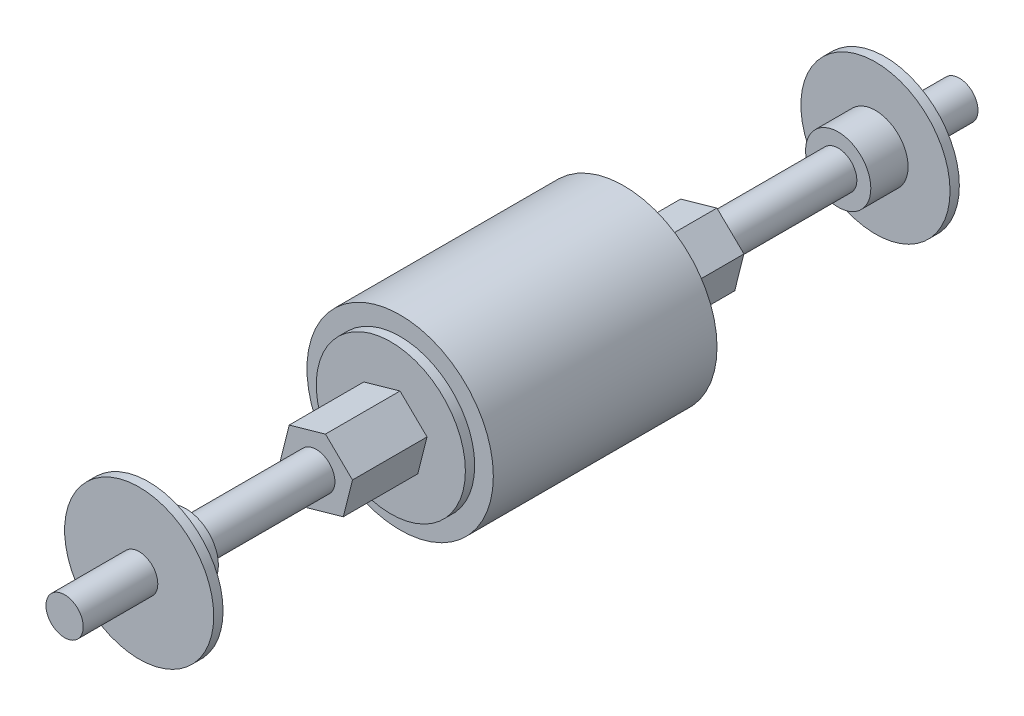
from build123d import *

# Parameters (mm, degrees)
SKETCH1_R           = 15.875
BOSS_EXTRUDE1_DEPTH = 19.05
SKETCH2_R           = 12.7
BOSS_EXTRUDE2_DEPTH = 1.5875
BOSS_EXTRUDE3_DEPTH = 12.7
SKETCH4_R           = 3.175
BOSS_EXTRUDE4_DEPTH = 22.225
SKETCH5_R           = 5.55625
BOSS_EXTRUDE6_DEPTH = 6.35
SKETCH6_R           = 12.7
BOSS_EXTRUDE7_DEPTH = 1.5875
SKETCH7_R           = 3.175
BOSS_EXTRUDE8_DEPTH = 12.7


with BuildPart() as part:
    # Sketch1 → Boss-Extrude1 (new body)
    with BuildSketch(Plane.XY):
        Circle(SKETCH1_R)
    boss_extrude1 = extrude(amount=BOSS_EXTRUDE1_DEPTH)

    # Sketch2 → Boss-Extrude2 (add)
    with BuildSketch(Plane.XY.offset(19.05)):
        Circle(SKETCH2_R)
    boss_extrude2 = extrude(amount=BOSS_EXTRUDE2_DEPTH)

    # Sketch3 → Boss-Extrude3 (add)
    with BuildSketch(Plane.XY.offset(20.6375)):
        Polygon((4.603141218, -4.469188183), (6.17200111, 1.75184314), (1.568859892, 6.221031323), (-4.603141218, 4.469188183), (-6.17200111, -1.75184314), (-1.568859892, -6.221031323), align=None)
    boss_extrude3 = extrude(amount=BOSS_EXTRUDE3_DEPTH)

    # Sketch4 → Boss-Extrude4 (add)
    with BuildSketch(Plane.XY.offset(33.3375)):
        Circle(SKETCH4_R)
    boss_extrude4 = extrude(amount=BOSS_EXTRUDE4_DEPTH)

    # Sketch5 → Boss-Extrude6 (add)
    with BuildSketch(Plane.XY.offset(55.5625)):
        Circle(SKETCH5_R)
    boss_extrude6 = extrude(amount=BOSS_EXTRUDE6_DEPTH)

    # Sketch6 → Boss-Extrude7 (add)
    with BuildSketch(Plane.XY.offset(61.9125)):
        Circle(SKETCH6_R)
    boss_extrude7 = extrude(amount=BOSS_EXTRUDE7_DEPTH)

    # Sketch7 → Boss-Extrude8 (add)
    with BuildSketch(Plane.XY.offset(63.5)):
        Circle(SKETCH7_R)
    boss_extrude8 = extrude(amount=BOSS_EXTRUDE8_DEPTH)

    # Mirror1: Boss-Extrude1, Boss-Extrude2, Boss-Extrude3, Boss-Extrude4, Boss-Extrude6, Boss-Extrude7, Boss-Extrude8 across plane
    add(boss_extrude1.mirror(Plane.XY))
    add(boss_extrude2.mirror(Plane.XY))
    add(boss_extrude3.mirror(Plane.XY))
    add(boss_extrude4.mirror(Plane.XY))
    add(boss_extrude6.mirror(Plane.XY))
    add(boss_extrude7.mirror(Plane.XY))
    add(boss_extrude8.mirror(Plane.XY))


solid = part.part
